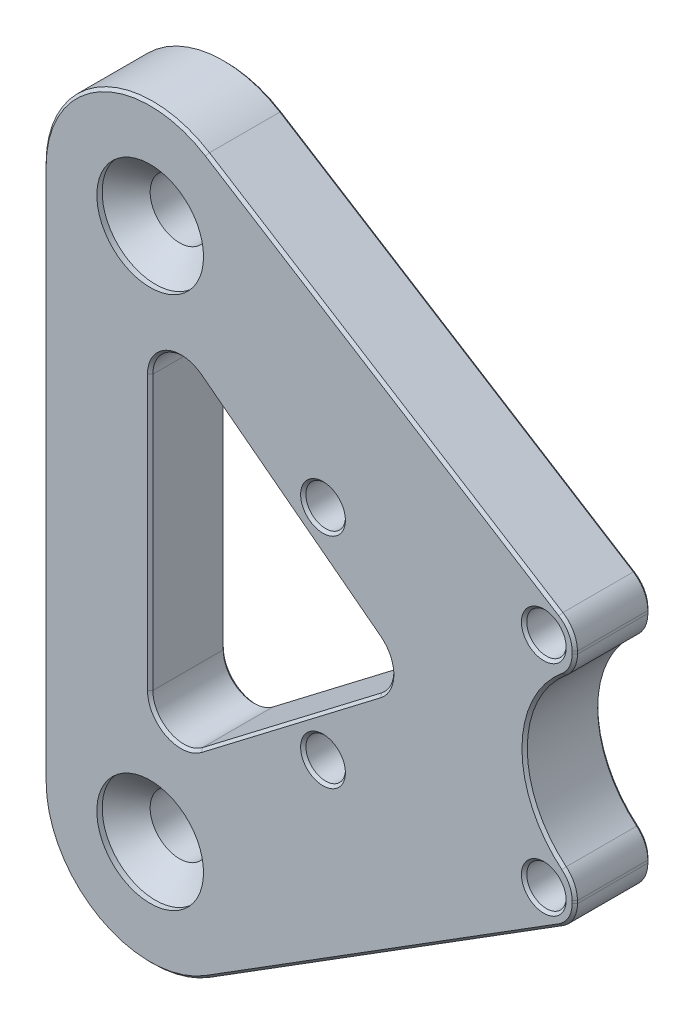
from build123d import *

# Parameters (mm, degrees)
SKETCH1_R                                      = 2.75
SKETCH1_R_2                                    = 1.25
BOSS_EXTRUDE1_DEPTH                            = 7.1
SKETCH2_R                                      = 1.85
CUT_EXTRUDE1_DEPTH                             = 5.6
FILLET1_R                                      = 2.9
CSK_FOR_M5_FLAT_HEAD_MACHINE_SCREW1_AT_2_COUNT = 2
CSK_FOR_M5_FLAT_HEAD_MACHINE_SCREW1_AT_2_PITCH = 50
CUT_EXTRUDE2_REACH                             = 57.666
FILLET2_R                                      = 2.9
CHAMFER1_SIZE                                  = 0.25


with BuildPart() as part:
    # Sketch1 → Boss-Extrude1 (new body)
    with BuildSketch(Plane.XY.offset(1.1)):
        with BuildLine():
            Line((5.73970382, 12.707187863), (-27.389452344, 33.473061595))
            ThreePointArc((-27.389452344, 33.473061595), (-37.542479112, 33.749585035), (-42.7005, 25))
            Line((-42.7005, 25), (-42.7005, -25))
            ThreePointArc((-42.7005, -25), (-37.542479112, -33.749585035), (-27.389452344, -33.473061595))
            Line((-27.389452344, -33.473061595), (5.73970382, -12.707187863))
            ThreePointArc((5.73970382, -12.707187863), (6.73687966, -11.654173942), (7.0995, -10.25))
            Line((7.0995, -10.25), (7.0995, -8.535221145))
            ThreePointArc((7.0995, -8.535221145), (3.652184023, -4.871857962), (2.3995, 0))
            ThreePointArc((2.3995, 0), (3.652184023, 4.871857962), (7.0995, 8.535221145))
            Line((7.0995, 8.535221145), (7.0995, 10.25))
            ThreePointArc((7.0995, 10.25), (6.73687966, 11.654173942), (5.73970382, 12.707187863))
        make_face()
        with Locations((-32.7005, -25)):
            Circle(SKETCH1_R, mode=Mode.SUBTRACT)
        with Locations((-16.5005, -10.25)):
            Circle(SKETCH1_R_2, mode=Mode.SUBTRACT)
        with Locations((4.1995, -10.25)):
            Circle(SKETCH1_R_2, mode=Mode.SUBTRACT)
        with Locations((-32.7005, 25)):
            Circle(SKETCH1_R, mode=Mode.SUBTRACT)
        with Locations((4.1995, 10.25)):
            Circle(SKETCH1_R_2, mode=Mode.SUBTRACT)
        with Locations((-16.5005, 10.25)):
            Circle(SKETCH1_R_2, mode=Mode.SUBTRACT)
    extrude(amount=BOSS_EXTRUDE1_DEPTH)

    # Sketch2 → Cut-Extrude1 (cut)
    with BuildSketch(Plane.XY.offset(8.2)):
        with Locations((-16.5005, 10.25)):
            Circle(SKETCH2_R)
        with Locations((4.1995, 10.25)):
            Circle(SKETCH2_R)
        with Locations((-16.5005, -10.25)):
            Circle(SKETCH2_R)
        with Locations((4.1995, -10.25)):
            Circle(SKETCH2_R)
    extrude(amount=-CUT_EXTRUDE1_DEPTH, mode=Mode.SUBTRACT)

    # Fillet1
    fillet1_edges = [part.edges().sort_by_distance(p)[0] for p in [
        (7.0995, 8.535221145, 4.65),
        (7.0995, -8.535221145, 4.65),
    ]]
    fillet(fillet1_edges, radius=FILLET1_R)

    # Sketch4 → CSK for M5 Flat Head Machine Screw1 (revolve, cut)
    with BuildSketch(Plane(origin=(-32.7005, 25, 8.2), x_dir=(0, -1, 0), z_dir=(1, 0, 0))):
        Polygon((0, 0), (0, 7.1), (2.75, 7.1), (2.75, 2.75), (5, 0.5), (5, 0), align=None)
    csk_for_m5_flat_head_machine_screw1 = revolve(axis=Axis((-32.7005, 25, 14.55), (0, 0, -1)), mode=Mode.SUBTRACT)

    # CSK for M5 Flat Head Machine Screw1 at 2: CSK for M5 Flat Head Machine Screw1 ×2
    with Locations(*[(0, -i * CSK_FOR_M5_FLAT_HEAD_MACHINE_SCREW1_AT_2_PITCH, 0) for i in range(1, CSK_FOR_M5_FLAT_HEAD_MACHINE_SCREW1_AT_2_COUNT)]):
        add(csk_for_m5_flat_head_machine_screw1, mode=Mode.SUBTRACT)

    # Sketch5 → Cut-Extrude2 (cut, up to next)
    with BuildSketch(Plane.XY.offset(8.2), mode=Mode.PRIVATE) as cut_extrude2_sk1:
        Polygon((-8.232430261, 0), (-32.7005, 18.706189308), (-32.7005, -18.706189308), align=None)
    cut_extrude2_tool1 = extrude(cut_extrude2_sk1.sketch, amount=-CUT_EXTRUDE2_REACH, mode=Mode.PRIVATE) & part.part
    add(cut_extrude2_tool1.solids().sort_by_distance((-24.544477, 0, 8.2))[0], mode=Mode.SUBTRACT)

    # Fillet2
    fillet2_edges = [part.edges().sort_by_distance(p)[0] for p in [
        (-8.232430261, 0, 4.65),
        (-32.7005, -18.706189308, 4.65),
        (-32.7005, 18.706189308, 4.65),
    ]]
    fillet(fillet2_edges, radius=FILLET2_R)

    # Chamfer1
    chamfer1_edges = [part.edges().sort_by_distance(p)[0] for p in [
        (-37.542479112, -33.749585035, 8.2),
        (-19.642543112, -8.723194486, 8.2),
        (-19.642543112, -8.723194486, 1.1),
        (-32.7005, 0, 1.1),
        (-32.7005, 0, 8.2),
        (-19.642543112, 8.723194486, 1.1),
        (-19.642543112, 8.723194486, 8.2),
        (-31.08544208, -15.438480665, 8.2),
        (-31.08544208, -15.438480665, 1.1),
        (-10.107239813, 0, 8.2),
        (-10.107239813, 0, 1.1),
        (-31.08544208, 15.438480665, 8.2),
        (-31.08544208, 15.438480665, 1.1),
        (-10.824874262, -23.090124729, 8.2),
        (-35.4505, -25, 1.1),
        (-35.4505, 25, 1.1),
        (-17.7505, 10.25, 1.1),
        (2.9495, -10.25, 1.1),
        (2.9495, 10.25, 1.1),
        (6.73687966, -11.654173942, 8.2),
        (-17.7505, -10.25, 1.1),
        (-42.7005, 0, 1.1),
        (-37.542479112, 33.749585035, 1.1),
        (-10.824874262, 23.090124729, 1.1),
        (6.73687966, 11.654173942, 1.1),
        (7.0995, 10.127749244, 1.1),
        (6.73687966, -11.654173942, 1.1),
        (-10.824874262, -23.090124729, 1.1),
        (-37.542479112, -33.749585035, 1.1),
        (7.0995, 10.127749244, 8.2),
        (6.73687966, 11.654173942, 8.2),
        (-10.824874262, 23.090124729, 8.2),
        (-37.542479112, 33.749585035, 8.2),
        (-42.7005, 0, 8.2),
        (2.3495, 10.25, 8.2),
        (2.3495, 10.25, 2.6),
        (-18.3505, -10.25, 8.2),
        (-18.3505, -10.25, 2.6),
        (2.3495, -10.25, 8.2),
        (2.3495, -10.25, 2.6),
        (-18.3505, 10.25, 8.2),
        (-18.3505, 10.25, 2.6),
        (2.3995, 0, 1.1),
        (2.3995, 0, 8.2),
        (7.0995, -10.127749244, 1.1),
        (6.824329665, 8.772506505, 1.1),
        (6.824329665, -8.772506505, 1.1),
        (7.0995, -10.127749244, 8.2),
        (6.824329665, 8.772506505, 8.2),
        (6.824329665, -8.772506505, 8.2),
    ]]
    chamfer(chamfer1_edges, length=CHAMFER1_SIZE)


solid = part.part
